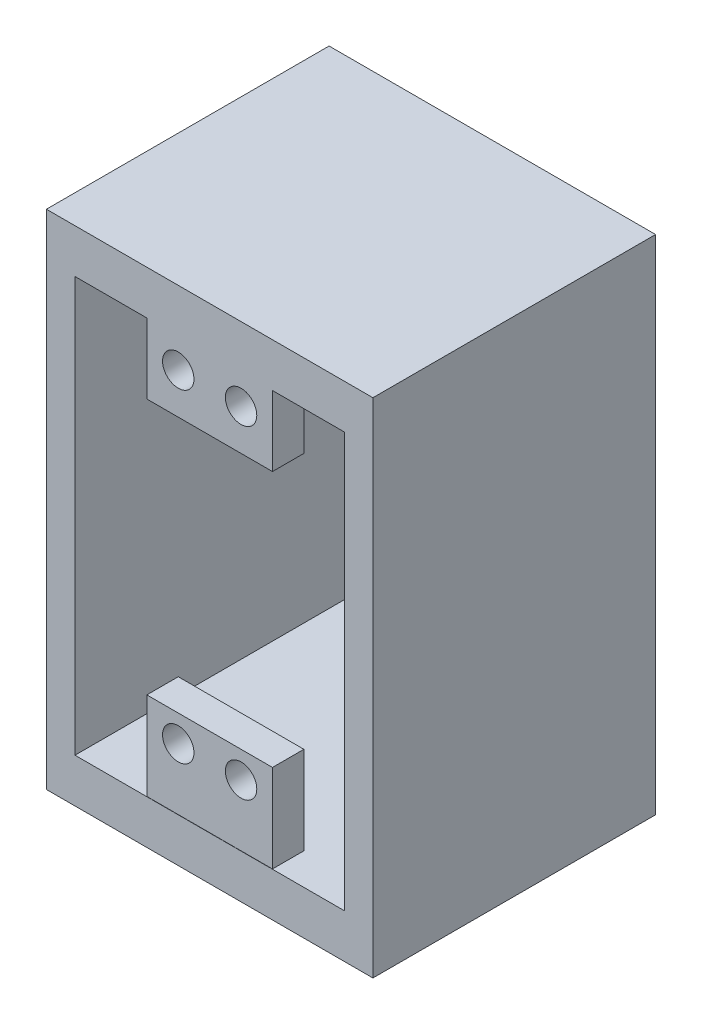
from build123d import *

# Parameters (mm, degrees)
SKIZZE1_W                         = 20
SKIZZE1_H                         = 11.18
SKIZZE1_R                         = 2.5
AUFSATZ_LINEAR_AUSTRAGEN1_DEPTH   = 5
SKIZZE1_H_2                       = 14
AUFSATZ_LINEAR_AUSTRAGEN1_2_DEPTH = 5
SKIZZE3_W                         = 51.975705294
SKIZZE3_H                         = 80
SKIZZE3_W_2                       = 42.879956868
SKIZZE3_H_2                       = 66
AUFSATZ_LINEAR_AUSTRAGEN2_DEPTH   = 45


with BuildPart() as part:
    # Skizze1 → Aufsatz-Linear austragen1 (new body)
    with BuildSketch(Plane.XY):
        with Locations((-10, 60.38)):
            Rectangle(SKIZZE1_W, SKIZZE1_H)
        with Locations((-15, 61.276751707)):
            Circle(SKIZZE1_R, mode=Mode.SUBTRACT)
        with Locations((-5, 61.276751707)):
            Circle(SKIZZE1_R, mode=Mode.SUBTRACT)
    extrude(amount=AUFSATZ_LINEAR_AUSTRAGEN1_DEPTH)

    # Skizze3 → Aufsatz-Linear austragen2 (add)
    with BuildSketch(Plane.XY.offset(5)):
        with Locations((-10, 32.961965548)):
            Rectangle(SKIZZE3_W, SKIZZE3_H)
        with Locations((-10, 32.961965548)):
            Rectangle(SKIZZE3_W_2, SKIZZE3_H_2, mode=Mode.SUBTRACT)
    extrude(amount=-AUFSATZ_LINEAR_AUSTRAGEN2_DEPTH)


with BuildPart() as body_2:
    # Skizze1 → Aufsatz-Linear austragen1 2 (new body)
    with BuildSketch(Plane.XY):
        with Locations((-10, 7)):
            Rectangle(SKIZZE1_W, SKIZZE1_H_2)
        with Locations((-15, 9.761216808)):
            Circle(SKIZZE1_R, mode=Mode.SUBTRACT)
        with Locations((-5, 9.761216808)):
            Circle(SKIZZE1_R, mode=Mode.SUBTRACT)
    extrude(amount=AUFSATZ_LINEAR_AUSTRAGEN1_2_DEPTH)


solid = Compound([part.part, body_2.part])
